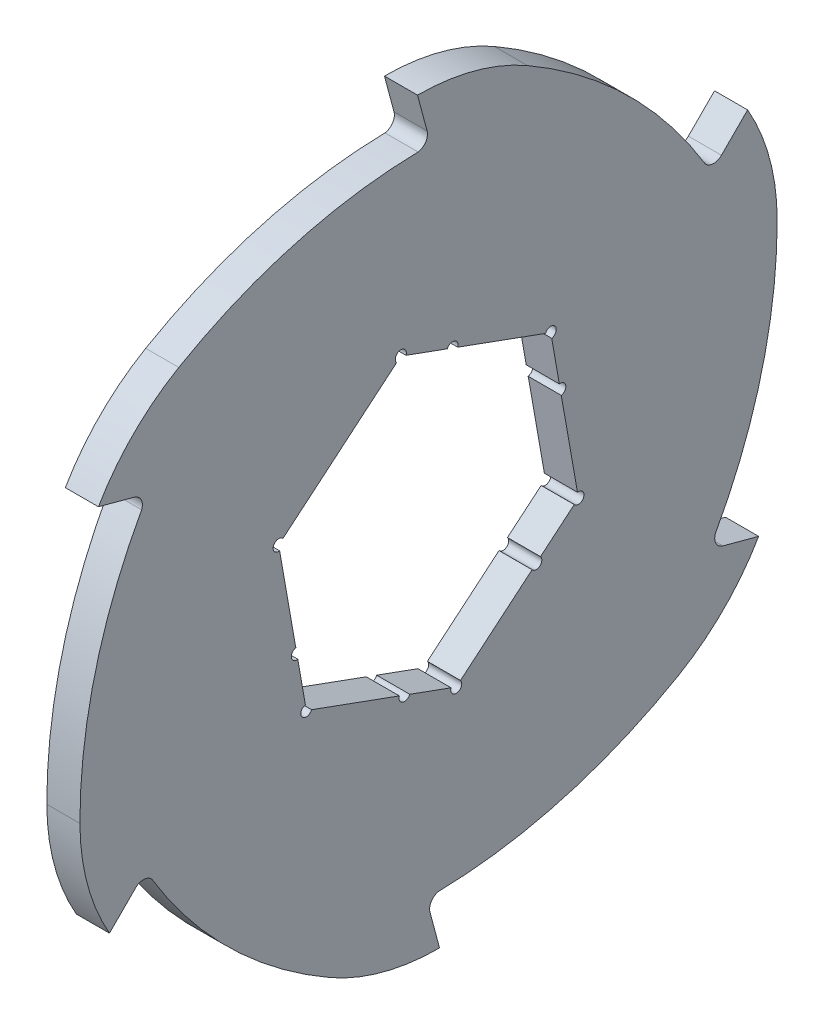
from build123d import *

# Parameters (mm, degrees)
SKETCH1_R                = 59
EXTRUDE1_DEPTH           = 3
EXTRUDE2_DEPTH           = 3
CIRPATTERN1_COUNT        = 6
F_2_0_2_DIAMETER_HOLE1_D = 2
F_2_0_2_DIAMETER_HOLE3_D = 2
CIRPATTERN2_COUNT        = 5
CIRPATTERN2_ANGLE        = 240


with BuildPart() as part:
    # Sketch1 → Extrude1 (new, symmetric)
    with BuildSketch(Plane(origin=(0, 0, 0), x_dir=(0, 0, -1), z_dir=(1, 0, 0))):
        Circle(SKETCH1_R)
        Polygon((22.158025869, 18.592791334), (-5.022816688, 28.485808967), (-27.180842557, 9.893017633), (-22.158025869, -18.592791334), (5.022816688, -28.485808967), (27.180842557, -9.893017633), align=None, mode=Mode.SUBTRACT)
    extrude(amount=EXTRUDE1_DEPTH, both=True)

    # Sketch2 → Extrude2 (add, symmetric)
    with BuildSketch(Plane(origin=(0, 0, 0), x_dir=(0, 0, -1), z_dir=(1, 0, 0))):
        with BuildLine():
            Line((-2, 67.961805723), (-0.262709442, 61.478149092))
            ThreePointArc((-0.262709442, 61.478149092), (-0.58620663, 59.77173183), (-2.122608272, 58.961805723))
            ThreePointArc((-2.122608272, 58.961805723), (28.679663449, 51.560419941), (51.21368579, 29.294340542))
            ThreePointArc((51.21368579, 29.294340542), (36.791707484, 48.186627241), (17.927108603, 62.644803614))
            ThreePointArc((17.927108603, 62.644803614), (8.312130826, 66.609702921), (-2, 67.961805723))
        make_face()
    extrude2 = extrude(amount=EXTRUDE2_DEPTH, both=True)

    # CirPattern1: Extrude2 ×6 about axis
    cirpattern1_axis = Axis((0, 0, 0), (1, 0, 0))
    for i in range(1, CIRPATTERN1_COUNT):
        add(extrude2.rotate(cirpattern1_axis, i * 360 / CIRPATTERN1_COUNT))

    # Ø2.0 (2) Diameter Hole1 (through all)
    with Locations(Plane(origin=(3, 0, 0), x_dir=(0, 0, -1), z_dir=(1, 0, 0))):
        with Locations((-5.022816688, 28.485808967), (22.158025869, 18.592791334), (27.180842557, -9.893017633), (5.022816688, -28.485808967), (-22.158025869, -18.592791334), (-27.180842557, 9.893017633)):
            Hole(F_2_0_2_DIAMETER_HOLE1_D / 2)

    # Ø2.0 (2) Diameter Hole3 (through all)
    with Locations(Plane(origin=(3, 0, 0), x_dir=(0, 0, -1), z_dir=(1, 0, 0))):
        with Locations((4.350695038, 25.074129708)):
            f_2_0_2_diameter_hole3 = Hole(F_2_0_2_DIAMETER_HOLE3_D / 2)

    # CirPattern2: Ø2.0 (2) Diameter Hole3 ×5 about axis
    cirpattern2_axis = Axis((0, 0, 0), (-1, 0, 0))
    for i in range(1, CIRPATTERN2_COUNT):
        add(f_2_0_2_diameter_hole3.rotate(cirpattern2_axis, i * CIRPATTERN2_ANGLE / (CIRPATTERN2_COUNT - 1)), mode=Mode.SUBTRACT)


solid = part.part
